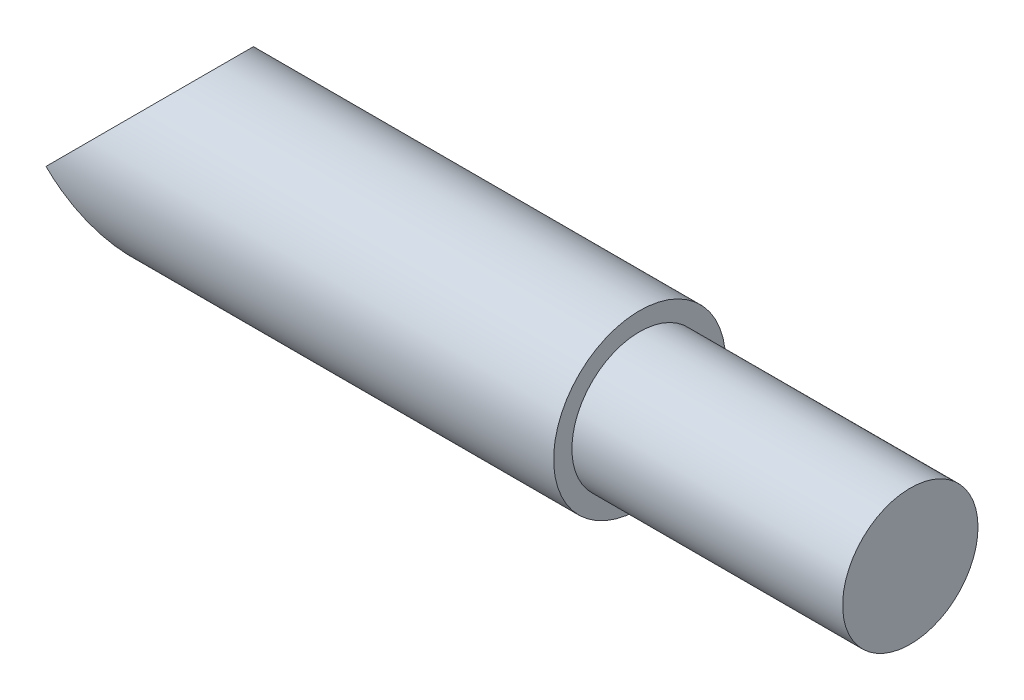
from build123d import *

# Parameters (mm, degrees)
SKETCH1_R           = 12.7
BOSS_EXTRUDE1_DEPTH = 75
SKETCH5_R           = 12.7
CUT_EXTRUDE1_DEPTH  = 37.5
SKETCH2_R           = 10
BOSS_EXTRUDE2_DEPTH = 40


with BuildPart() as part:
    # Sketch1 → Boss-Extrude1 (new body)
    with BuildSketch(Plane(origin=(0, 0, 0), x_dir=(0, 0, -1), z_dir=(1, 0, 0))):
        Circle(SKETCH1_R)
    extrude(amount=BOSS_EXTRUDE1_DEPTH)

    # Sketch5 → Cut-Extrude1 (cut, symmetric)
    with BuildSketch(Plane(origin=(0, 0, 0), x_dir=(1, 0, 0), z_dir=(0, 1, 0))):
        Circle(SKETCH5_R)
    extrude(amount=CUT_EXTRUDE1_DEPTH, both=True, mode=Mode.SUBTRACT)

    # Sketch2 → Boss-Extrude2 (add)
    with BuildSketch(Plane(origin=(75, 0, 0), x_dir=(0, 0, -1), z_dir=(1, 0, 0))):
        Circle(SKETCH2_R)
    extrude(amount=BOSS_EXTRUDE2_DEPTH)


solid = part.part
